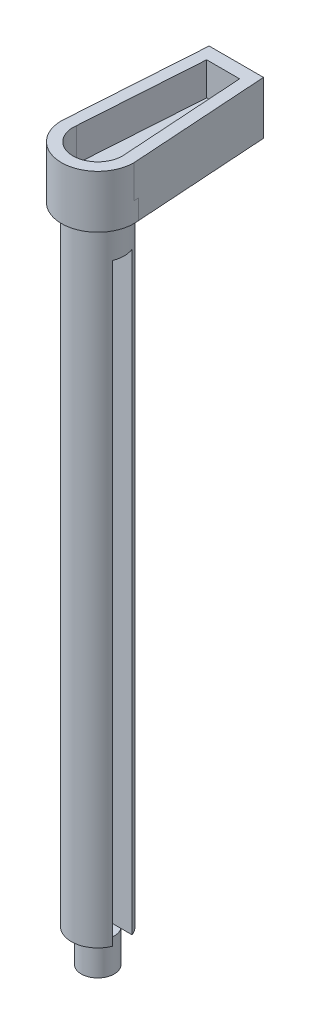
from build123d import *
from build123d.topology import SkipClean

# Parameters (mm, degrees)
SKETCH2_W                = 50
SKETCH2_H                = 90
BOSS_EXTRUDE1_DEPTH      = 1.5
BOSS_EXTRUDE2_DEPTH      = 45
BOSS_EXTRUDE2_DEPTH_BACK = 50
SKETCH3_R                = 4
BOSS_EXTRUDE3_DEPTH      = 3
BOSS_EXTRUDE4_DEPTH      = 5
SKETCH6_W                = 3
SKETCH6_H                = 90
CUT_EXTRUDE1_DEPTH       = 50
SKETCH7_R                = 2.5
BOSS_EXTRUDE5_DEPTH      = 5


with BuildPart() as part:
    # Sketch2 → Boss-Extrude1 (new, symmetric)
    with BuildSketch(Plane.XY):
        Rectangle(SKETCH2_W, SKETCH2_H)
    extrude(amount=BOSS_EXTRUDE1_DEPTH, both=True)

    # Sketch3 → Boss-Extrude2 (add, two sides: drawn at the far end of the back side and taken through both)
    with BuildSketch(Plane.XZ.offset(-BOSS_EXTRUDE2_DEPTH_BACK)):
        with Locations(Location((-25, 0, 0), (0, 0, 270))):
            Circle(SKETCH3_R)
    extrude(amount=BOSS_EXTRUDE2_DEPTH + BOSS_EXTRUDE2_DEPTH_BACK)

    # Sketch4 → Boss-Extrude3 (add)
    with BuildSketch(Plane(origin=(0, 50, 0), x_dir=(1, 0, 0), z_dir=(0, 1, 0))):
        with BuildLine():
            ThreePointArc((-30.45259438, 0.72056542), (-25, -5.5), (-19.54740562, 0.72056542))
            Line((-19.54740562, 0.72056542), (-20.881578947, 21))
            Line((-20.881578947, 21), (-29.118421053, 21))
            Line((-29.118421053, 21), (-30.45259438, 0.72056542))
        make_face()
    extrude(amount=BOSS_EXTRUDE3_DEPTH)

    # Sketch5 → Boss-Extrude4 (add)
    with SkipClean():  # the faces are left unmerged after this step: merging them gives an invalid solid
        with BuildSketch(Plane(origin=(0, 53, -53), x_dir=(1, 0, 0), z_dir=(0, -1, 0))):
            with BuildLine():
                Line((-30.5, 53), (-29.118421053, 32))
                Line((-29.118421053, 32), (-20.881578947, 32))
                Line((-20.881578947, 32), (-19.5, 53))
                ThreePointArc((-19.5, 53), (-25, 58.5), (-30.5, 53))
            make_face()
            with BuildLine():
                ThreePointArc((-28.717677987, 52.508705396), (-25, 56.75), (-21.282322013, 52.508705396))
                Line((-21.282322013, 52.508705396), (-22.5, 34))
                Line((-22.5, 34), (-27.5, 34))
                Line((-27.5, 34), (-28.717677987, 52.508705396))
            make_face(mode=Mode.SUBTRACT)
        extrude(amount=-BOSS_EXTRUDE4_DEPTH)

    # Sketch6 → Cut-Extrude1 (cut)
    with SkipClean():  # the faces are left unmerged after this step: merging them gives an invalid solid
        with BuildSketch(Plane(origin=(25, 0, 0), x_dir=(0, 0, -1), z_dir=(1, 0, 0))):
            Rectangle(SKETCH6_W, SKETCH6_H)
        extrude(amount=-CUT_EXTRUDE1_DEPTH, mode=Mode.SUBTRACT)

    # Sketch7 → Boss-Extrude5 (add)
    with SkipClean():  # the faces are left unmerged after this step: merging them gives an invalid solid
        with BuildSketch(Plane.XZ.offset(45)):
            with Locations(Location((-25, 0, 0), (0, 0, 36.869897646))):
                Circle(SKETCH7_R)
        extrude(amount=BOSS_EXTRUDE5_DEPTH)


solid = part.part
